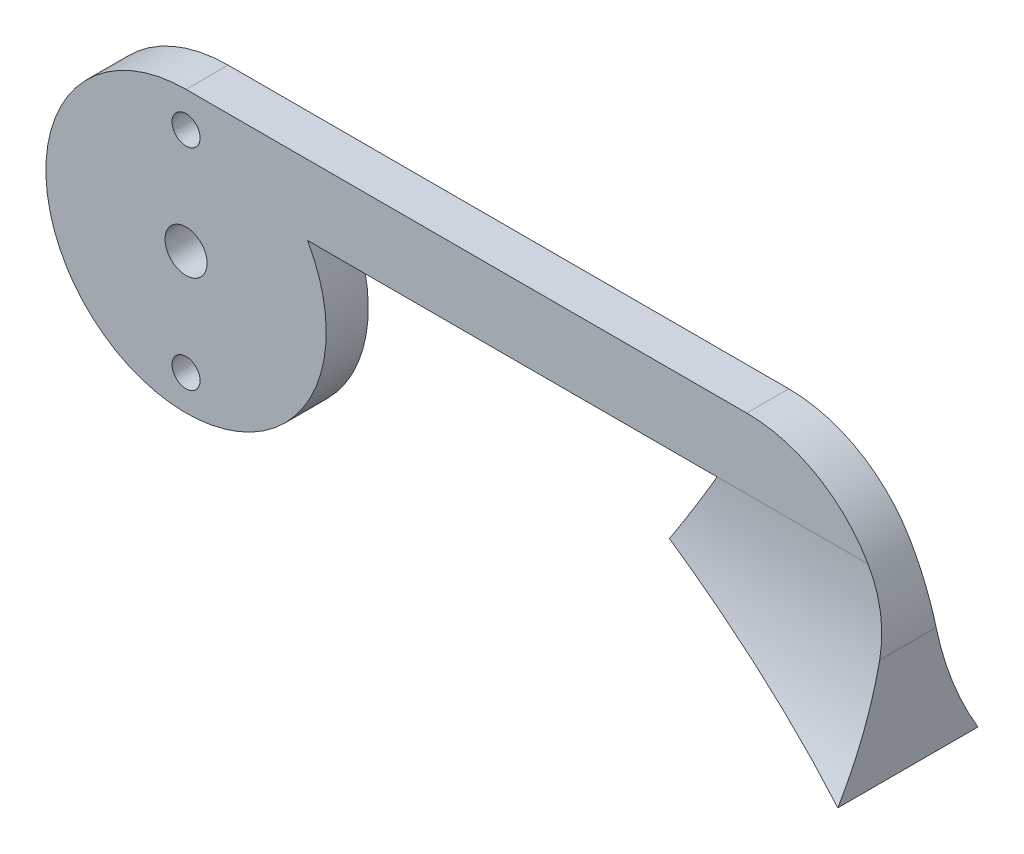
from build123d import *

# Parameters (mm, degrees)
SKETCH1_R           = 1.5
BOSS_EXTRUDE1_DEPTH = 1.5
BOSS_EXTRUDE2_DEPTH = 5
CUT_EXTRUDE1_START  = -12.113249
SKETCH3_OUTSIDE_W   = 24.806
SKETCH3_OUTSIDE_H   = 34.806
CUT_EXTRUDE1_DEPTH  = 15
SKETCH4_R           = 1
CUT_EXTRUDE2_DEPTH  = 52.402821


with BuildPart() as part:
    # Sketch1 → Boss-Extrude1 (new, symmetric)
    with BuildSketch(Plane.XY):
        with BuildLine():
            Line((0, 10), (40, 10))
            ThreePointArc((40, 10), (47.071068, 7.071068), (50, 0))
            Line((50, 0), (35, 0))
            Line((35, 0), (37.886751, 5))
            Line((37.886751, 5), (8.660254, 5))
            ThreePointArc((8.660254, 5), (-5, -8.660254), (0, 10))
        make_face()
        Circle(SKETCH1_R, mode=Mode.SUBTRACT)
    extrude(amount=BOSS_EXTRUDE1_DEPTH, both=True)

    # Sketch2 → Boss-Extrude2 (add, symmetric)
    with BuildSketch(Plane.XY):
        with BuildLine():
            Line((37.886751, 5), (37.886751, 10))
            Line((37.886751, 10), (40, 10))
            ThreePointArc((40, 10), (47.071068, 7.071068), (50, 0))
            Line((50, 0), (50, -7.642882))
            Line((50, -7.642882), (35, 0))
            Line((35, 0), (37.886751, 5))
        make_face()
    extrude(amount=BOSS_EXTRUDE2_DEPTH, both=True)

    # Sketch3 outside → Cut-Extrude1 (cut)
    with BuildSketch(Plane.ZY.offset(-37.886751).offset(CUT_EXTRUDE1_START)):
        Rectangle(SKETCH3_OUTSIDE_W, SKETCH3_OUTSIDE_H)
        with BuildLine():
            Line((-1.5, 10), (-1.5, 5))
            ThreePointArc((-1.5, 5), (-2.391151, -1.559201), (-5, -7.642882))
            Line((-5, -7.642882), (5, -7.642882))
            ThreePointArc((5, -7.642882), (2.391151, -1.559201), (1.5, 5))
            Line((1.5, 5), (1.5, 10))
            Line((1.5, 10), (-1.5, 10))
        make_face(mode=Mode.SUBTRACT)
    extrude(amount=CUT_EXTRUDE1_DEPTH, mode=Mode.SUBTRACT)

    # Sketch4 → Cut-Extrude2 (cut, through all)
    with BuildSketch(Plane(origin=(0, 0, -1.5), x_dir=(-1, 0, 0), z_dir=(0, 0, -1))):
        with Locations((0, 7.5)):
            Circle(SKETCH4_R)
        with Locations((0, -7.5)):
            Circle(SKETCH4_R)
    extrude(amount=-CUT_EXTRUDE2_DEPTH, mode=Mode.SUBTRACT)


solid = part.part
